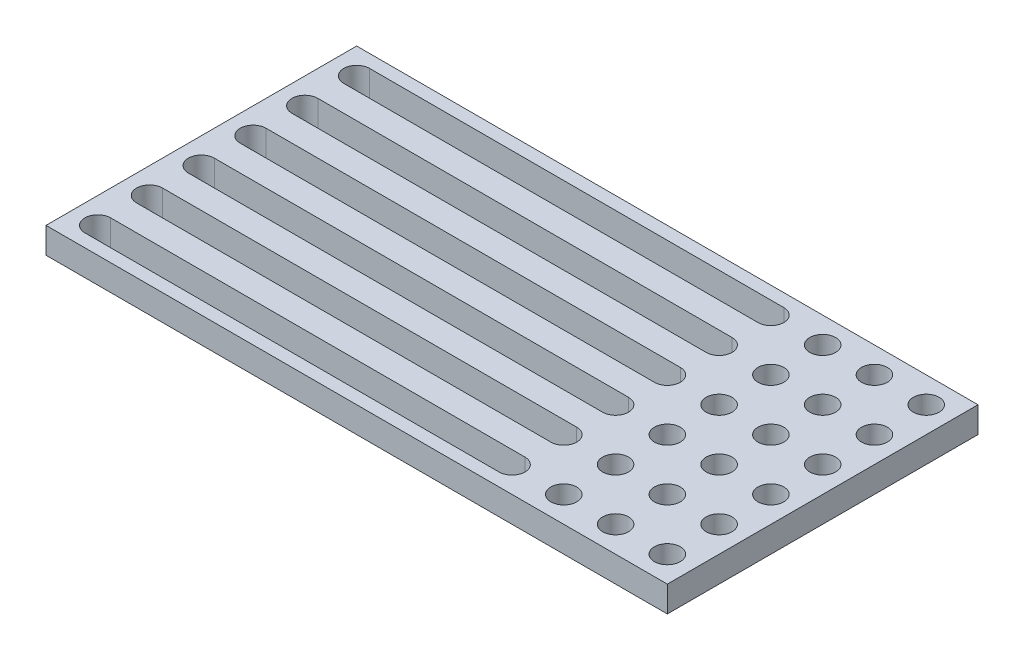
from build123d import *

# Parameters (mm, degrees)
SKETCH1_W           = 152.4
SKETCH1_H           = 76.2
SKETCH1_R           = 3.175
BOSS_EXTRUDE1_DEPTH = 6.35


with BuildPart() as part:
    # Sketch1 → Boss-Extrude1 (new body)
    with BuildSketch(Plane(origin=(0, 0, 0), x_dir=(1, 0, 0), z_dir=(0, 1, 0))):
        Rectangle(SKETCH1_W, SKETCH1_H)
        with Locations(Location((44.45, 31.75, 0), (0, 0, 270))):
            Circle(SKETCH1_R, mode=Mode.SUBTRACT)
        with Locations(Location((57.15, 31.75, 0), (0, 0, 270))):
            Circle(SKETCH1_R, mode=Mode.SUBTRACT)
        with Locations(Location((69.85, 31.75, 0), (0, 0, 270))):
            Circle(SKETCH1_R, mode=Mode.SUBTRACT)
        with Locations(Location((44.45, 19.05, 0), (0, 0, 270))):
            Circle(SKETCH1_R, mode=Mode.SUBTRACT)
        with Locations(Location((57.15, 19.05, 0), (0, 0, 270))):
            Circle(SKETCH1_R, mode=Mode.SUBTRACT)
        with Locations(Location((69.85, 19.05, 0), (0, 0, 270))):
            Circle(SKETCH1_R, mode=Mode.SUBTRACT)
        with Locations(Location((44.45, 6.35, 0), (0, 0, 270))):
            Circle(SKETCH1_R, mode=Mode.SUBTRACT)
        with Locations(Location((57.15, 6.35, 0), (0, 0, 270))):
            Circle(SKETCH1_R, mode=Mode.SUBTRACT)
        with Locations(Location((69.85, 6.35, 0), (0, 0, 270))):
            Circle(SKETCH1_R, mode=Mode.SUBTRACT)
        with Locations(Location((44.45, -6.35, 0), (0, 0, 270))):
            Circle(SKETCH1_R, mode=Mode.SUBTRACT)
        with Locations(Location((57.15, -6.35, 0), (0, 0, 270))):
            Circle(SKETCH1_R, mode=Mode.SUBTRACT)
        with Locations(Location((69.85, -6.35, 0), (0, 0, 270))):
            Circle(SKETCH1_R, mode=Mode.SUBTRACT)
        with Locations(Location((44.45, -19.05, 0), (0, 0, 270))):
            Circle(SKETCH1_R, mode=Mode.SUBTRACT)
        with Locations(Location((57.15, -19.05, 0), (0, 0, 270))):
            Circle(SKETCH1_R, mode=Mode.SUBTRACT)
        with Locations(Location((69.85, -19.05, 0), (0, 0, 270))):
            Circle(SKETCH1_R, mode=Mode.SUBTRACT)
        with Locations(Location((44.45, -31.75, 0), (0, 0, 270))):
            Circle(SKETCH1_R, mode=Mode.SUBTRACT)
        with Locations(Location((57.15, -31.75, 0), (0, 0, 270))):
            Circle(SKETCH1_R, mode=Mode.SUBTRACT)
        with Locations(Location((69.85, -31.75, 0), (0, 0, 270))):
            Circle(SKETCH1_R, mode=Mode.SUBTRACT)
        with BuildLine():
            Line((-69.85, 34.925), (31.75, 34.925))
            ThreePointArc((31.75, 34.925), (34.925, 31.75), (31.75, 28.575))
            Line((31.75, 28.575), (-69.85, 28.575))
            ThreePointArc((-69.85, 28.575), (-73.025, 31.75), (-69.85, 34.925))
        make_face(mode=Mode.SUBTRACT)
        with BuildLine():
            Line((31.75, 15.875), (-69.85, 15.875))
            ThreePointArc((-69.85, 15.875), (-73.025, 19.05), (-69.85, 22.225))
            Line((-69.85, 22.225), (31.75, 22.225))
            ThreePointArc((31.75, 22.225), (34.925, 19.05), (31.75, 15.875))
        make_face(mode=Mode.SUBTRACT)
        with BuildLine():
            Line((31.75, 3.175), (-69.85, 3.175))
            ThreePointArc((-69.85, 3.175), (-73.025, 6.35), (-69.85, 9.525))
            Line((-69.85, 9.525), (31.75, 9.525))
            ThreePointArc((31.75, 9.525), (34.925, 6.35), (31.75, 3.175))
        make_face(mode=Mode.SUBTRACT)
        with BuildLine():
            Line((31.75, -9.525), (-69.85, -9.525))
            ThreePointArc((-69.85, -9.525), (-73.025, -6.35), (-69.85, -3.175))
            Line((-69.85, -3.175), (31.75, -3.175))
            ThreePointArc((31.75, -3.175), (34.925, -6.35), (31.75, -9.525))
        make_face(mode=Mode.SUBTRACT)
        with BuildLine():
            Line((31.75, -22.225), (-69.85, -22.225))
            ThreePointArc((-69.85, -22.225), (-73.025, -19.05), (-69.85, -15.875))
            Line((-69.85, -15.875), (31.75, -15.875))
            ThreePointArc((31.75, -15.875), (34.925, -19.05), (31.75, -22.225))
        make_face(mode=Mode.SUBTRACT)
        with BuildLine():
            Line((31.75, -34.925), (-69.85, -34.925))
            ThreePointArc((-69.85, -34.925), (-73.025, -31.75), (-69.85, -28.575))
            Line((-69.85, -28.575), (31.75, -28.575))
            ThreePointArc((31.75, -28.575), (34.925, -31.75), (31.75, -34.925))
        make_face(mode=Mode.SUBTRACT)
    extrude(amount=BOSS_EXTRUDE1_DEPTH)


solid = part.part
